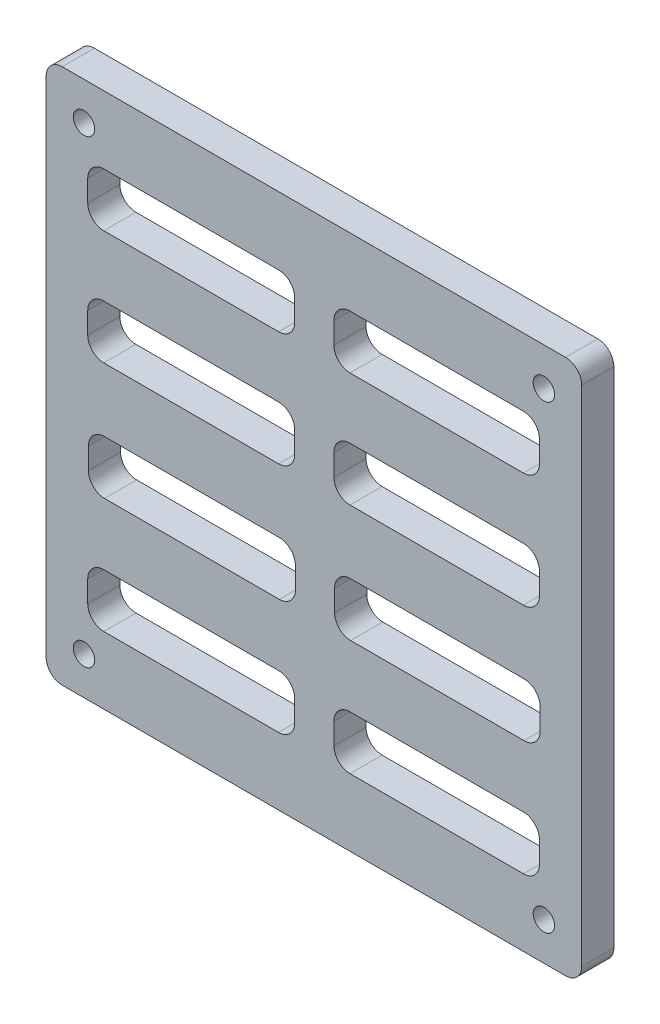
from build123d import *

# Parameters (mm, degrees)
SALIENTE_EXTRUIR2_DEPTH      = 10
SALIENTE_EXTRUIR2_DEPTH_BACK = 2
CROQUIS1_R                   = 4


with BuildPart() as part:
    # Croquis1 → Saliente-Extruir2 (new, two sides: drawn at the far end of the back side and taken through both)
    with BuildSketch(Plane.XY.offset(-SALIENTE_EXTRUIR2_DEPTH_BACK)):
        with BuildLine():
            Line((-94, -100), (94, -100))
            ThreePointArc((94, -100), (98.242640687, -98.242640687), (100, -94))
            Line((100, -94), (100, 94))
            ThreePointArc((100, 94), (98.242640687, 98.242640687), (94, 100))
            Line((94, 100), (-94, 100))
            ThreePointArc((-94, 100), (-98.242640687, 98.242640687), (-100, 94))
            Line((-100, 94), (-100, -94))
            ThreePointArc((-100, -94), (-98.242640687, -98.242640687), (-94, -100))
        make_face()
        with Locations((-85.874076582, 85.874076582)):
            Circle(CROQUIS1_R, mode=Mode.SUBTRACT)
        with Locations((85.874076582, 85.874076582)):
            Circle(CROQUIS1_R, mode=Mode.SUBTRACT)
        with Locations((85.874076582, -85.874076582)):
            Circle(CROQUIS1_R, mode=Mode.SUBTRACT)
        with Locations((-85.874076582, -85.874076582)):
            Circle(CROQUIS1_R, mode=Mode.SUBTRACT)
        with BuildLine():
            Line((-78.475041975, 54.708172492), (-13.195035121, 54.708172492))
            ThreePointArc((-13.195035121, 54.708172492), (-8.952394434, 56.465531805), (-7.195035121, 60.708172492))
            Line((-7.195035121, 60.708172492), (-7.195035121, 68.708172492))
            ThreePointArc((-7.195035121, 68.708172492), (-8.952394434, 72.95081318), (-13.195035121, 74.708172492))
            Line((-13.195035121, 74.708172492), (-78.475041975, 74.708172492))
            ThreePointArc((-78.475041975, 74.708172492), (-82.717682662, 72.95081318), (-84.475041975, 68.708172492))
            Line((-84.475041975, 68.708172492), (-84.475041975, 60.708172492))
            ThreePointArc((-84.475041975, 60.708172492), (-82.717682662, 56.465531805), (-78.475041975, 54.708172492))
        make_face(mode=Mode.SUBTRACT)
        with BuildLine():
            Line((-78.475041975, 11.984829536), (-13.195035121, 11.984829536))
            ThreePointArc((-13.195035121, 11.984829536), (-8.952394434, 13.742188849), (-7.195035121, 17.984829536))
            Line((-7.195035121, 17.984829536), (-7.195035121, 25.984829536))
            ThreePointArc((-7.195035121, 25.984829536), (-8.952394434, 30.227470223), (-13.195035121, 31.984829536))
            Line((-13.195035121, 31.984829536), (-78.475041975, 31.984829536))
            ThreePointArc((-78.475041975, 31.984829536), (-82.717682662, 30.227470223), (-84.475041975, 25.984829536))
            Line((-84.475041975, 25.984829536), (-84.475041975, 17.984829536))
            ThreePointArc((-84.475041975, 17.984829536), (-82.717682662, 13.742188849), (-78.475041975, 11.984829536))
        make_face(mode=Mode.SUBTRACT)
        with BuildLine():
            Line((-78.208559193, -31.718346754), (-12.928552339, -31.718346754))
            ThreePointArc((-12.928552339, -31.718346754), (-8.685911652, -29.960987441), (-6.928552339, -25.718346754))
            Line((-6.928552339, -25.718346754), (-6.928552339, -17.718346754))
            ThreePointArc((-6.928552339, -17.718346754), (-8.685911652, -13.475706067), (-12.928552339, -11.718346754))
            Line((-12.928552339, -11.718346754), (-78.208559193, -11.718346754))
            ThreePointArc((-78.208559193, -11.718346754), (-82.45119988, -13.475706067), (-84.208559193, -17.718346754))
            Line((-84.208559193, -17.718346754), (-84.208559193, -25.718346754))
            ThreePointArc((-84.208559193, -25.718346754), (-82.45119988, -29.960987441), (-78.208559193, -31.718346754))
        make_face(mode=Mode.SUBTRACT)
        with BuildLine():
            Line((-78.475041975, -74.888557479), (-13.195035121, -74.888557479))
            ThreePointArc((-13.195035121, -74.888557479), (-8.952394434, -73.131198166), (-7.195035121, -68.888557479))
            Line((-7.195035121, -68.888557479), (-7.195035121, -60.888557479))
            ThreePointArc((-7.195035121, -60.888557479), (-8.952394434, -56.645916792), (-13.195035121, -54.888557479))
            Line((-13.195035121, -54.888557479), (-78.475041975, -54.888557479))
            ThreePointArc((-78.475041975, -54.888557479), (-82.717682662, -56.645916792), (-84.475041975, -60.888557479))
            Line((-84.475041975, -60.888557479), (-84.475041975, -68.888557479))
            ThreePointArc((-84.475041975, -68.888557479), (-82.717682662, -73.131198166), (-78.475041975, -74.888557479))
        make_face(mode=Mode.SUBTRACT)
        with BuildLine():
            Line((13.461517903, 11.984829536), (78.208559193, 11.984829536))
            ThreePointArc((78.208559193, 11.984829536), (82.45119988, 13.742188849), (84.208559193, 17.984829536))
            Line((84.208559193, 17.984829536), (84.208559193, 25.984829536))
            ThreePointArc((84.208559193, 25.984829536), (82.45119988, 30.227470223), (78.208559193, 31.984829536))
            Line((78.208559193, 31.984829536), (13.461517903, 31.984829536))
            ThreePointArc((13.461517903, 31.984829536), (9.218877216, 30.227470223), (7.461517903, 25.984829536))
            Line((7.461517903, 25.984829536), (7.461517903, 17.984829536))
            ThreePointArc((7.461517903, 17.984829536), (9.218877216, 13.742188849), (13.461517903, 11.984829536))
        make_face(mode=Mode.SUBTRACT)
        with BuildLine():
            Line((13.461517903, 54.708172492), (78.208559193, 54.708172492))
            ThreePointArc((78.208559193, 54.708172492), (82.45119988, 56.465531805), (84.208559193, 60.708172492))
            Line((84.208559193, 60.708172492), (84.208559193, 68.708172492))
            ThreePointArc((84.208559193, 68.708172492), (82.45119988, 72.95081318), (78.208559193, 74.708172492))
            Line((78.208559193, 74.708172492), (13.461517903, 74.708172492))
            ThreePointArc((13.461517903, 74.708172492), (9.218877216, 72.95081318), (7.461517903, 68.708172492))
            Line((7.461517903, 68.708172492), (7.461517903, 60.708172492))
            ThreePointArc((7.461517903, 60.708172492), (9.218877216, 56.465531805), (13.461517903, 54.708172492))
        make_face(mode=Mode.SUBTRACT)
        with BuildLine():
            Line((13.728000685, -31.718346754), (78.475041975, -31.718346754))
            ThreePointArc((78.475041975, -31.718346754), (82.717682662, -29.960987441), (84.475041975, -25.718346754))
            Line((84.475041975, -25.718346754), (84.475041975, -17.718346754))
            ThreePointArc((84.475041975, -17.718346754), (82.717682662, -13.475706067), (78.475041975, -11.718346754))
            Line((78.475041975, -11.718346754), (13.728000685, -11.718346754))
            ThreePointArc((13.728000685, -11.718346754), (9.485359998, -13.475706067), (7.728000685, -17.718346754))
            Line((7.728000685, -17.718346754), (7.728000685, -25.718346754))
            ThreePointArc((7.728000685, -25.718346754), (9.485359998, -29.960987441), (13.728000685, -31.718346754))
        make_face(mode=Mode.SUBTRACT)
        with BuildLine():
            Line((13.461517903, -74.888557479), (78.208559193, -74.888557479))
            ThreePointArc((78.208559193, -74.888557479), (82.45119988, -73.131198166), (84.208559193, -68.888557479))
            Line((84.208559193, -68.888557479), (84.208559193, -60.888557479))
            ThreePointArc((84.208559193, -60.888557479), (82.45119988, -56.645916792), (78.208559193, -54.888557479))
            Line((78.208559193, -54.888557479), (13.461517903, -54.888557479))
            ThreePointArc((13.461517903, -54.888557479), (9.218877216, -56.645916792), (7.461517903, -60.888557479))
            Line((7.461517903, -60.888557479), (7.461517903, -68.888557479))
            ThreePointArc((7.461517903, -68.888557479), (9.218877216, -73.131198166), (13.461517903, -74.888557479))
        make_face(mode=Mode.SUBTRACT)
    extrude(amount=SALIENTE_EXTRUIR2_DEPTH + SALIENTE_EXTRUIR2_DEPTH_BACK)


solid = part.part
